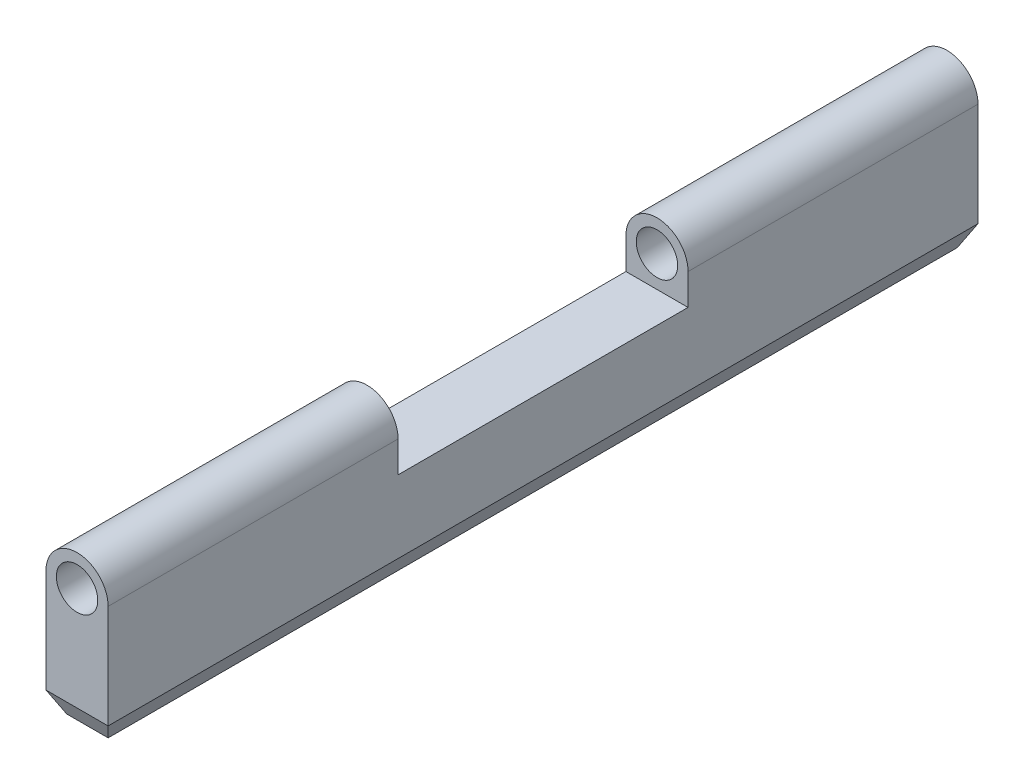
from build123d import *

# Parameters (mm, degrees)
SKETCH1_R               = 1
BOSS_EXTRUDE1_DEPTH     = 42
CUT_EXTRUDE1_DEPTH      = 43.253492101
CUT_EXTRUDE1_DEPTH_BACK = 43.253492101
SKETCH2_W               = 14
SKETCH2_H               = 3
CHAMFER1_SIZE           = 0.5
CHAMFER1_SIZE2          = 1


with BuildPart() as part:
    # Sketch1 → Boss-Extrude1 (new body)
    with BuildSketch(Plane.XY):
        with BuildLine():
            Line((-1.5, 2.871223481), (-1.5, -3.128776519))
            Line((-1.5, -3.128776519), (1.5, -3.128776519))
            Line((1.5, -3.128776519), (1.5, 2.871223481))
            ThreePointArc((1.5, 2.871223481), (0, 4.371223481), (-1.5, 2.871223481))
        make_face()
        with Locations(Location((0, 2.871223481, 0), (0, 0, 180))):
            Circle(SKETCH1_R, mode=Mode.SUBTRACT)
    extrude(amount=BOSS_EXTRUDE1_DEPTH)

    # Sketch2 → Cut-Extrude1 (cut, two sides: drawn at the far end of the back side and taken through both)
    with BuildSketch(Plane(origin=(0, 0, 0), x_dir=(0, 0, -1), z_dir=(1, 0, 0)).offset(-CUT_EXTRUDE1_DEPTH_BACK)):
        with Locations((-21, 2.871223481)):
            Rectangle(SKETCH2_W, SKETCH2_H)
    extrude(amount=CUT_EXTRUDE1_DEPTH + CUT_EXTRUDE1_DEPTH_BACK, mode=Mode.SUBTRACT)

    # Chamfer1
    chamfer1_edges = [part.edges().sort_by_distance(p)[0] for p in [
        (0, -3.128776519, 42),
        (0, -3.128776519, 0),
        (1.5, -3.128776519, 21),
        (-1.5, -3.128776519, 21),
    ]]
    chamfer1_side = [part.faces().sort_by_distance(p)[0] for p in [
        (0, -3.128776519, 21),
    ]]
    chamfer(chamfer1_edges, length=CHAMFER1_SIZE, length2=CHAMFER1_SIZE2, reference=chamfer1_side[0])


solid = part.part
